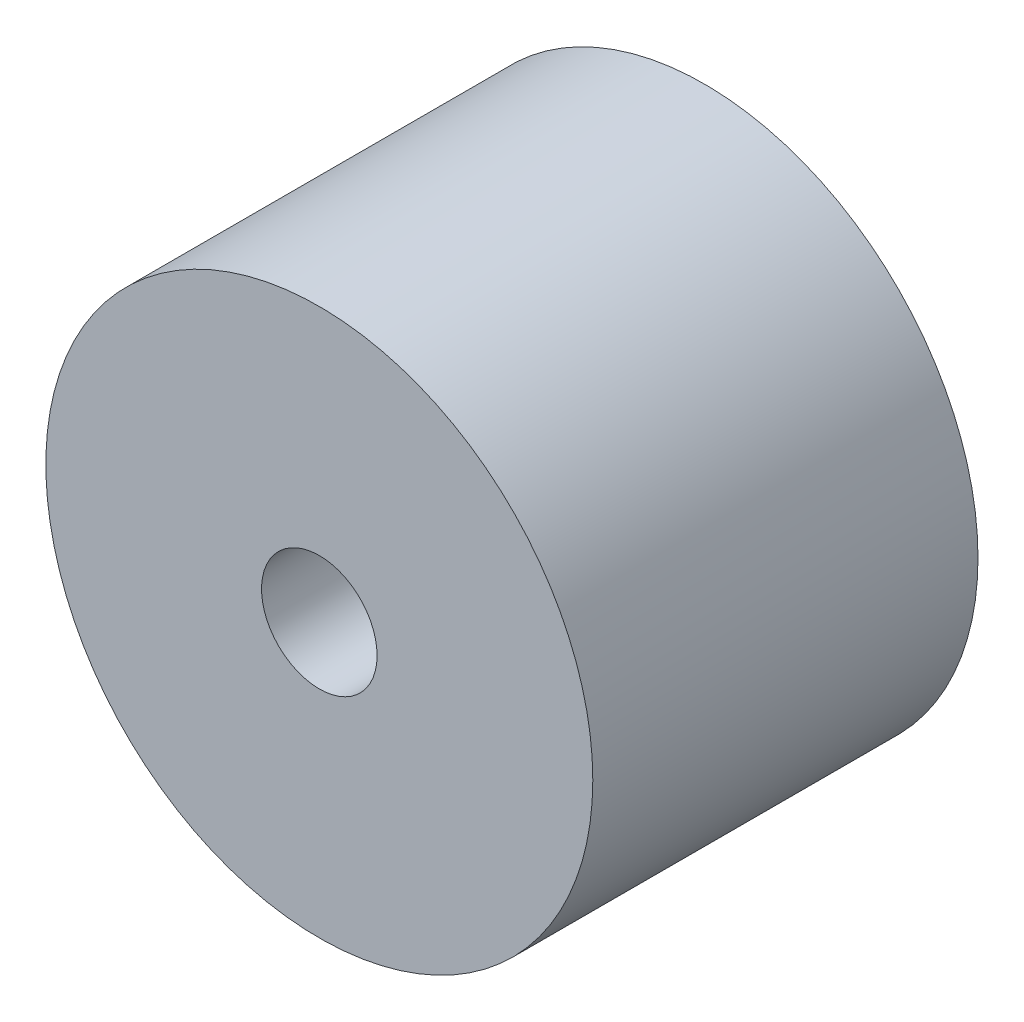
from build123d import *

# Parameters (mm, degrees)
SKETCH1_R                                      = 14.2
SKETCH1_R_2                                    = 3
CONNECTION_SPACE_ONLY_NO_THREADS_OR_SEAL_DEPTH = 20


with BuildPart() as part:
    # Sketch1 → Connection_space_only_NO_THREADS_OR_SEALS (new body)
    with BuildSketch(Plane.XY):
        Circle(SKETCH1_R)
        Circle(SKETCH1_R_2, mode=Mode.SUBTRACT)
    extrude(amount=CONNECTION_SPACE_ONLY_NO_THREADS_OR_SEAL_DEPTH)


solid = part.part
